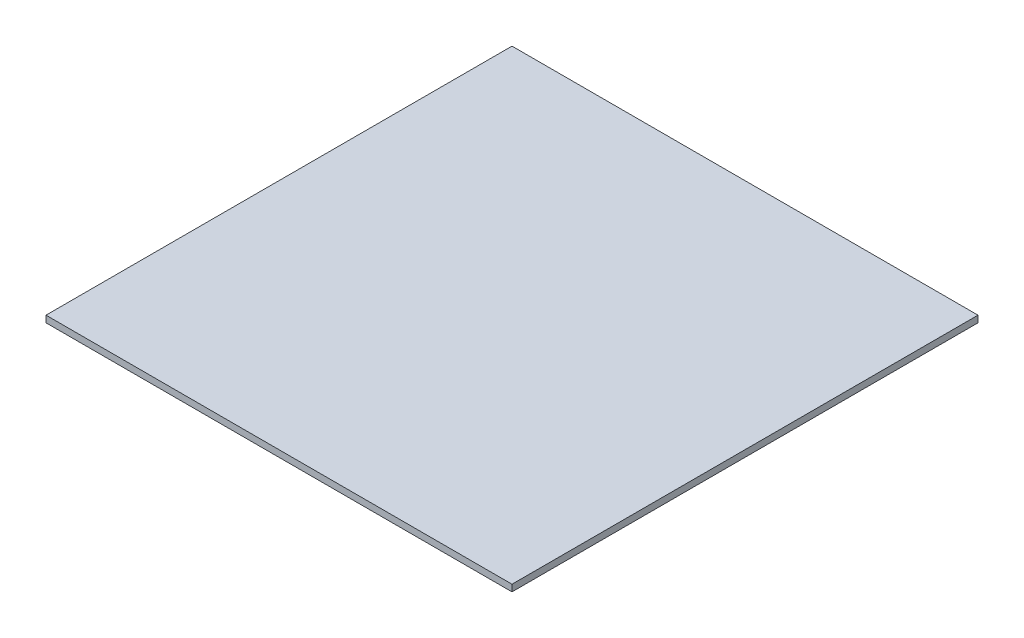
from build123d import *

# Parameters (mm, degrees)
SKETCH1_W           = 3500
SKETCH1_H           = 3500
BOSS_EXTRUDE1_DEPTH = 50
SKETCH2_W           = 750
SKETCH2_H           = 750
CUT_EXTRUDE1_DEPTH  = 10


with BuildPart() as part:
    # Sketch1 → Boss-Extrude1 (new body)
    with BuildSketch(Plane(origin=(0, 0, 0), x_dir=(1, 0, 0), z_dir=(0, 1, 0))):
        Rectangle(SKETCH1_W, SKETCH1_H)
    extrude(amount=BOSS_EXTRUDE1_DEPTH)

    # Sketch2 → Cut-Extrude1 (cut)
    with BuildSketch(Plane.XZ):
        Rectangle(SKETCH2_W, SKETCH2_H)
    extrude(amount=-CUT_EXTRUDE1_DEPTH, mode=Mode.SUBTRACT)


solid = part.part
